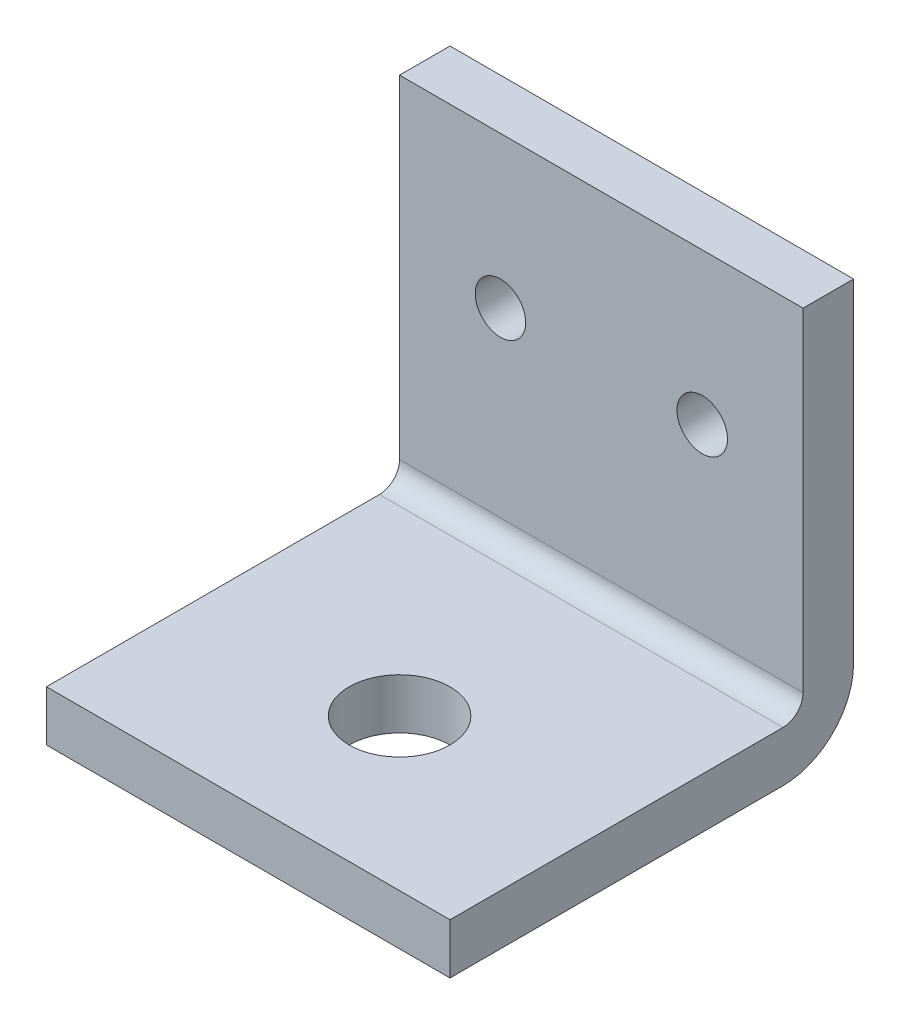
from build123d import *

# Parameters (mm, degrees)
BOSS_EXTRUDE1_DEPTH     = 40
SKETCH3_R               = 2.5
CUT_EXTRUDE2_DEPTH      = 40
CUT_EXTRUDE6_DEPTH      = 70.282032303
CUT_EXTRUDE6_DEPTH_BACK = 70.282032303
SKETCH4_R               = 5


with BuildPart() as part:
    # Sketch2 → Boss-Extrude1 (new body)
    with BuildSketch(Plane.YZ):
        with BuildLine():
            Line((40, 0), (7, 0))
            ThreePointArc((7, 0), (2.050252532, 2.050252532), (0, 7))
            Line((0, 7), (0, 40))
            Line((0, 40), (5, 40))
            Line((5, 40), (5, 7))
            ThreePointArc((5, 7), (5.585786438, 5.585786438), (7, 5))
            Line((7, 5), (40, 5))
            Line((40, 5), (40, 0))
        make_face()
    extrude(amount=BOSS_EXTRUDE1_DEPTH)

    # Sketch3 → Cut-Extrude2 (cut)
    with BuildSketch(Plane.XY.offset(5)):
        with Locations((10, 25)):
            Circle(SKETCH3_R)
        with Locations((30, 25)):
            Circle(SKETCH3_R)
    extrude(amount=-CUT_EXTRUDE2_DEPTH, mode=Mode.SUBTRACT)

    # Sketch4 → Cut-Extrude6 (cut, two sides: drawn at the far end of the back side and taken through both)
    with BuildSketch(Plane(origin=(0, 0, 0), x_dir=(-1, 0, 0), z_dir=(0, 1, 0)).offset(-CUT_EXTRUDE6_DEPTH_BACK)):
        with Locations(Location((-20, 25, 0), (0, 0, 90))):
            Circle(SKETCH4_R)
    extrude(amount=CUT_EXTRUDE6_DEPTH + CUT_EXTRUDE6_DEPTH_BACK, mode=Mode.SUBTRACT)


solid = part.part
